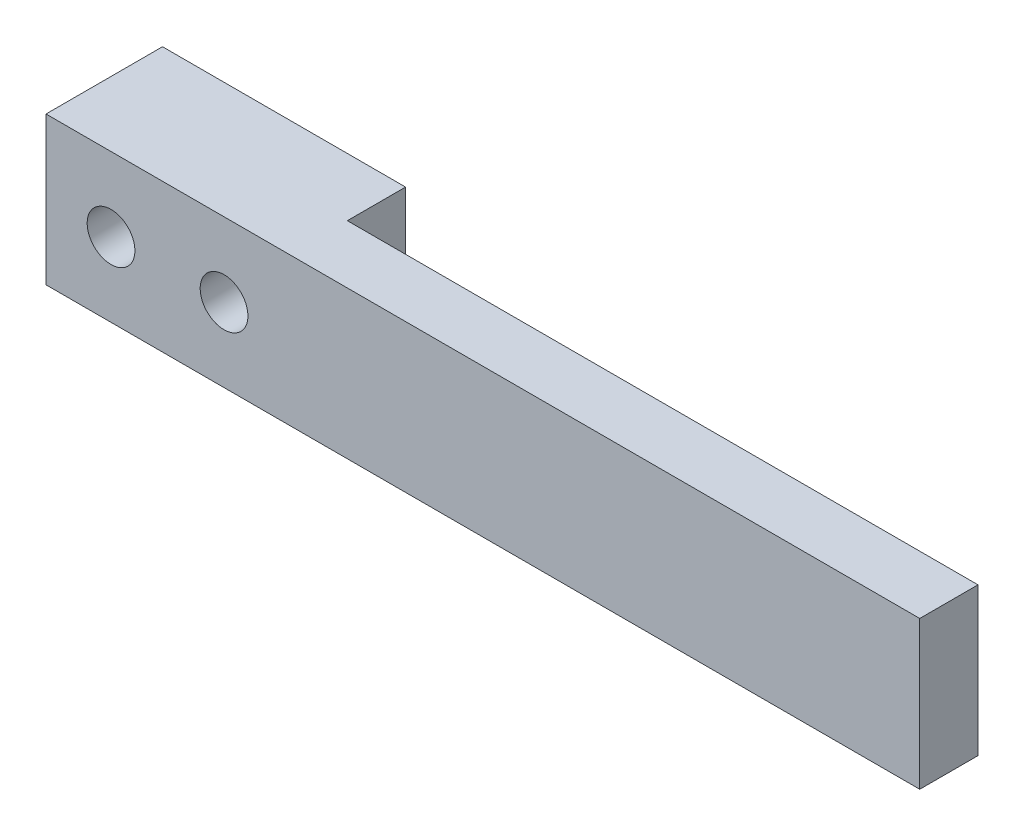
from build123d import *

# Parameters (mm, degrees)
BOSS_EXTRUDE1_DEPTH = 12.7
CUT_EXTRUDE1_DEPTH  = 12.7


with BuildPart() as part:
    # Sketch1 → Boss-Extrude1 (new body)
    with BuildSketch(Plane(origin=(0, 0, 0), x_dir=(1, 0, 0), z_dir=(0, 1, 0))):
        Polygon((-58.57612782, 0), (16.42387218, 0), (16.42387218, 5), (-37.711466165, 5), (-37.711466165, 10), (-58.57612782, 10), align=None)
    extrude(amount=BOSS_EXTRUDE1_DEPTH)

    # Sketch2 → Cut-Extrude1 (cut)
    with BuildSketch(Plane(origin=(0, 0, -10), x_dir=(-1, 0, 0), z_dir=(0, 0, -1))):
        with BuildLine():
            ThreePointArc((41.243796992, 6.35), (43.293796992, 4.3), (45.343796992, 6.35))
            Line((45.343796992, 6.35), (41.243796992, 6.35))
        make_face()
        with BuildLine():
            Line((41.243796992, 6.35), (45.343796992, 6.35))
            ThreePointArc((45.343796992, 6.35), (43.293796992, 8.4), (41.243796992, 6.35))
        make_face()
        with BuildLine():
            ThreePointArc((55.043796992, 6.35), (52.993796992, 8.4), (50.943796992, 6.35))
            Line((50.943796992, 6.35), (55.043796992, 6.35))
        make_face()
        with BuildLine():
            Line((55.043796992, 6.35), (50.943796992, 6.35))
            ThreePointArc((50.943796992, 6.35), (52.993796992, 4.3), (55.043796992, 6.35))
        make_face()
    extrude(amount=-CUT_EXTRUDE1_DEPTH, mode=Mode.SUBTRACT)


solid = part.part
